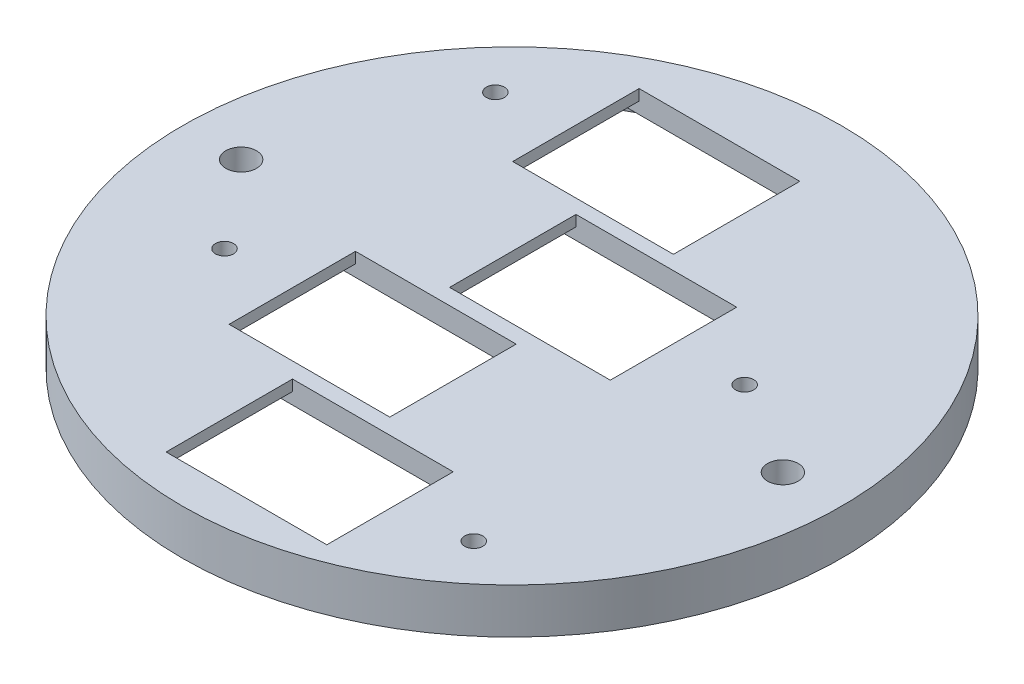
from build123d import *

# Parameters (mm, degrees)
SKETCH1_R            = 36.5
BOSS_EXTRUDE1_DEPTH  = 5
SKETCH2_W            = 22
SKETCH2_H            = 14
CUT_EXTRUDE1_DEPTH   = 2.5
SKETCH6_W            = 14
SKETCH6_H            = 1.2
BOSS_EXTRUDE2_DEPTH  = 2.1
SKETCH7_W            = 14
SKETCH7_H            = 1.2
BOSS_EXTRUDE3_DEPTH  = 2.1
SKETCH8_W            = 14
SKETCH8_H            = 1.2
BOSS_EXTRUDE4_DEPTH  = 2.1
SKETCH10_W           = 14
SKETCH10_H           = 1.2
BOSS_EXTRUDE10_DEPTH = 2.1
SKETCH21_W           = 14
SKETCH21_H           = 1.2
BOSS_EXTRUDE11_DEPTH = 2.1
SKETCH13_W           = 14
SKETCH13_H           = 1.2
BOSS_EXTRUDE7_DEPTH  = 2.1
SKETCH14_W           = 14
SKETCH14_H           = 1.2
BOSS_EXTRUDE8_DEPTH  = 2.1
SKETCH18_W           = 14
SKETCH18_H           = 1.2
BOSS_EXTRUDE9_DEPTH  = 2.1
SKETCH20_R           = 36
CUT_EXTRUDE3_DEPTH   = 2.5
SKETCH22_R           = 1
CUT_EXTRUDE4_DEPTH   = 10
SKETCH24_R           = 1.7
CUT_EXTRUDE5_DEPTH   = 87.833561687


with BuildPart() as part:
    # Sketch1 → Boss-Extrude1 (new body)
    with BuildSketch(Plane(origin=(0, 0, 0), x_dir=(1, 0, 0), z_dir=(0, 1, 0))):
        with Locations(Location((33.33972472, -14.85640453, 0), (0, 0, 270))):
            Circle(SKETCH1_R)
    extrude(amount=BOSS_EXTRUDE1_DEPTH)

    # Sketch2 → Cut-Extrude1 (cut)
    with BuildSketch(Plane(origin=(0, 5, 0), x_dir=(1, 0, 0), z_dir=(0, 1, 0))):
        with Locations((36.135698514, -40.062546055)):
            Rectangle(SKETCH2_W, SKETCH2_H)
        with Locations((27.374405596, -24.326629568)):
            Rectangle(SKETCH2_W, SKETCH2_H)
        with Locations((27.467621635, 6.993959585)):
            Rectangle(SKETCH2_W, SKETCH2_H)
        with Locations((36.043497237, -8.573118952)):
            Rectangle(SKETCH2_W, SKETCH2_H)
    extrude(amount=-CUT_EXTRUDE1_DEPTH, mode=Mode.SUBTRACT)

    # Sketch6 → Boss-Extrude2 (add)
    with BuildSketch(Plane.ZY.offset(-38.467621635)):
        with Locations((-6.993959585, 4.4)):
            Rectangle(SKETCH6_W, SKETCH6_H)
    extrude(amount=BOSS_EXTRUDE2_DEPTH)

    # Sketch7 → Boss-Extrude3 (add)
    with BuildSketch(Plane(origin=(16.467621635, 0, 0), x_dir=(0, 0, -1), z_dir=(1, 0, 0))):
        with Locations((6.993959585, 4.4)):
            Rectangle(SKETCH7_W, SKETCH7_H)
    extrude(amount=BOSS_EXTRUDE3_DEPTH)

    # Sketch8 → Boss-Extrude4 (add)
    with BuildSketch(Plane(origin=(25.043497237, 0, 0), x_dir=(0, 0, -1), z_dir=(1, 0, 0))):
        with Locations((-8.573118952, 4.4)):
            Rectangle(SKETCH8_W, SKETCH8_H)
    extrude(amount=BOSS_EXTRUDE4_DEPTH)

    # Sketch10 → Boss-Extrude10 (add)
    with BuildSketch(Plane.ZY.offset(-47.043497237)):
        with Locations((8.573118952, 4.4)):
            Rectangle(SKETCH10_W, SKETCH10_H)
    extrude(amount=BOSS_EXTRUDE10_DEPTH)

    # Sketch21 → Boss-Extrude11 (add)
    with BuildSketch(Plane.ZY.offset(-38.374405596)):
        with Locations((24.326629568, 4.4)):
            Rectangle(SKETCH21_W, SKETCH21_H)
    extrude(amount=BOSS_EXTRUDE11_DEPTH)

    # Sketch13 → Boss-Extrude7 (add)
    with BuildSketch(Plane(origin=(16.374405596, 0, 0), x_dir=(0, 0, -1), z_dir=(1, 0, 0))):
        with Locations((-24.326629568, 4.4)):
            Rectangle(SKETCH13_W, SKETCH13_H)
    extrude(amount=BOSS_EXTRUDE7_DEPTH)

    # Sketch14 → Boss-Extrude8 (add)
    with BuildSketch(Plane.ZY.offset(-47.135698514)):
        with Locations((40.062546055, 4.4)):
            Rectangle(SKETCH14_W, SKETCH14_H)
    extrude(amount=BOSS_EXTRUDE8_DEPTH)

    # Sketch18 → Boss-Extrude9 (add)
    with BuildSketch(Plane(origin=(25.135698514, 0, 0), x_dir=(0, 0, -1), z_dir=(1, 0, 0))):
        with Locations((-40.062546055, 4.4)):
            Rectangle(SKETCH18_W, SKETCH18_H)
    extrude(amount=BOSS_EXTRUDE9_DEPTH)

    # Sketch20 → Cut-Extrude3 (cut)
    with BuildSketch(Plane.XZ):
        with Locations(Location((33.33972472, 14.85640453, 0), (0, 0, 270))):
            Circle(SKETCH20_R)
    extrude(amount=-CUT_EXTRUDE3_DEPTH, mode=Mode.SUBTRACT)

    # Sketch22 → Cut-Extrude4 (cut)
    with BuildSketch(Plane(origin=(0, 5, 0), x_dir=(1, 0, 0), z_dir=(0, 1, 0))):
        with Locations(Location((52.821638574, -38.573118952, 0), (0, 0, 270))):
            Circle(SKETCH22_R)
        with Locations(Location((10.967875326, -24.326629568, 0), (0, 0, 270))):
            Circle(SKETCH22_R)
        with Locations(Location((10.967875326, 5.673370432, 0), (0, 0, 270))):
            Circle(SKETCH22_R)
        with Locations(Location((52.821876902, -8.573118953, 0), (0, 0, 270))):
            Circle(SKETCH22_R)
    extrude(amount=-CUT_EXTRUDE4_DEPTH, mode=Mode.SUBTRACT)

    # Sketch24 → Cut-Extrude5 (cut, through all)
    with BuildSketch(Plane(origin=(0, 5, 0), x_dir=(1, 0, 0), z_dir=(0, 1, 0))):
        with Locations(Location((63.33972472, -14.85640453, 0), (0, 0, 270))):
            Circle(SKETCH24_R)
        with Locations(Location((3.33972472, -14.85640453, 0), (0, 0, 270))):
            Circle(SKETCH24_R)
    extrude(amount=-CUT_EXTRUDE5_DEPTH, mode=Mode.SUBTRACT)


solid = part.part
